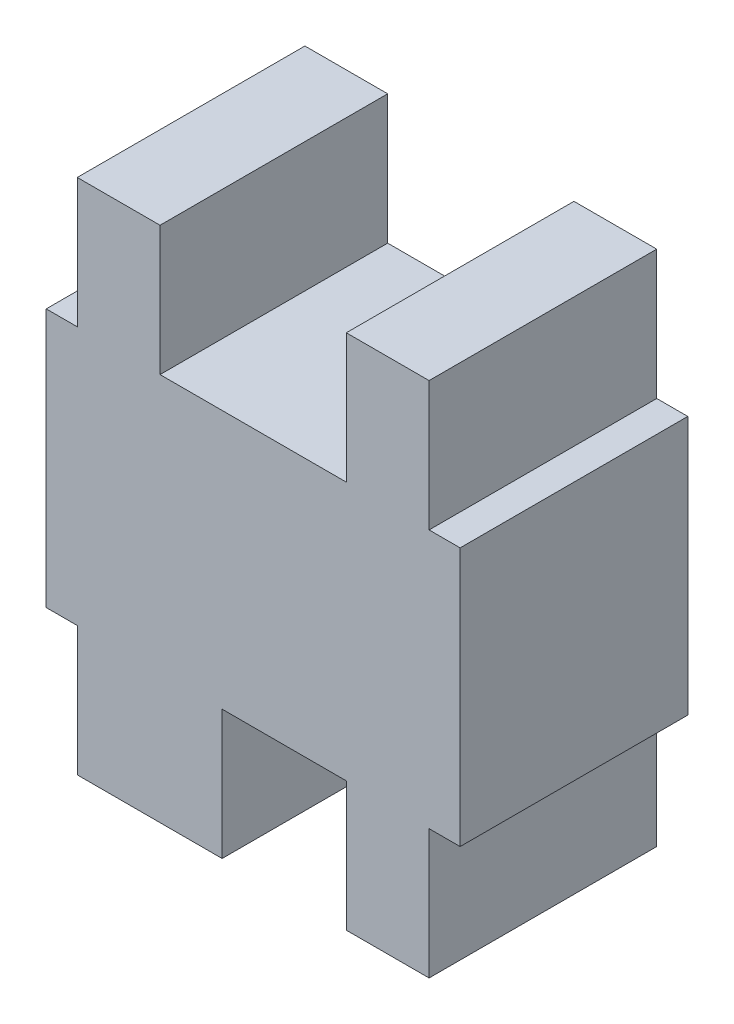
from build123d import *

# Parameters (mm, degrees)
COMPONENT_OUTLINE_DEPTH = 1.1


with BuildPart() as part:
    # 草图1 → Component_Outline (new body)
    with BuildSketch(Plane.XY):
        Polygon((-1, 0.625), (-0.85, 0.625), (-0.85, 1.25), (-0.45, 1.25), (-0.45, 0.625), (0.45, 0.625), (0.45, 1.25), (0.85, 1.25), (0.85, 0.625), (1, 0.625), (1, -0.625), (0.85, -0.625), (0.85, -1.25), (0.45, -1.25), (0.45, -0.625), (-0.15, -0.625), (-0.15, -1.25), (-0.85, -1.25), (-0.85, -0.625), (-1, -0.625), align=None)
    extrude(amount=COMPONENT_OUTLINE_DEPTH)


solid = part.part
